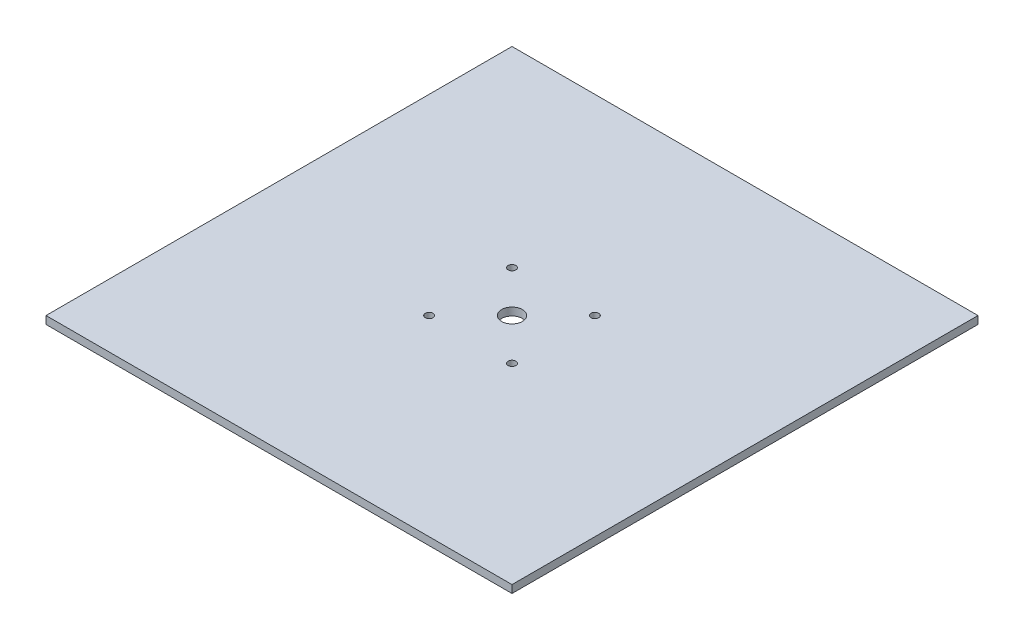
from build123d import *

# Parameters (mm, degrees)
SKETCH1_W               = 180
SKETCH1_H               = 180
BOSS_EXTRUDE1_DEPTH     = 3
CUT_EXTRUDE1_DEPTH      = 128.314571044
CUT_EXTRUDE1_DEPTH_BACK = 128.314571044
SKETCH2_R               = 4
SKETCH2_R_2             = 1.5


with BuildPart() as part:
    # Sketch1 → Boss-Extrude1 (new body)
    with BuildSketch(Plane(origin=(0, 0, 0), x_dir=(1, 0, 0), z_dir=(0, 1, 0))):
        Rectangle(SKETCH1_W, SKETCH1_H)
    extrude(amount=BOSS_EXTRUDE1_DEPTH)

    # Sketch2 → Cut-Extrude1 (cut, two sides: drawn at the far end of the back side and taken through both)
    with BuildSketch(Plane(origin=(0, 3, 0), x_dir=(1, 0, 0), z_dir=(0, 1, 0)).offset(-CUT_EXTRUDE1_DEPTH_BACK)):
        with Locations(Location((0, 0, 0), (0, 0, 270))):
            Circle(SKETCH2_R)
        with Locations(Location((-16, 16, 0), (0, 0, 270))):
            Circle(SKETCH2_R_2)
        with Locations(Location((16, 16, 0), (0, 0, 270))):
            Circle(SKETCH2_R_2)
        with Locations(Location((16, -16, 0), (0, 0, 270))):
            Circle(SKETCH2_R_2)
        with Locations(Location((-16, -16, 0), (0, 0, 270))):
            Circle(SKETCH2_R_2)
    extrude(amount=CUT_EXTRUDE1_DEPTH + CUT_EXTRUDE1_DEPTH_BACK, mode=Mode.SUBTRACT)


solid = part.part
